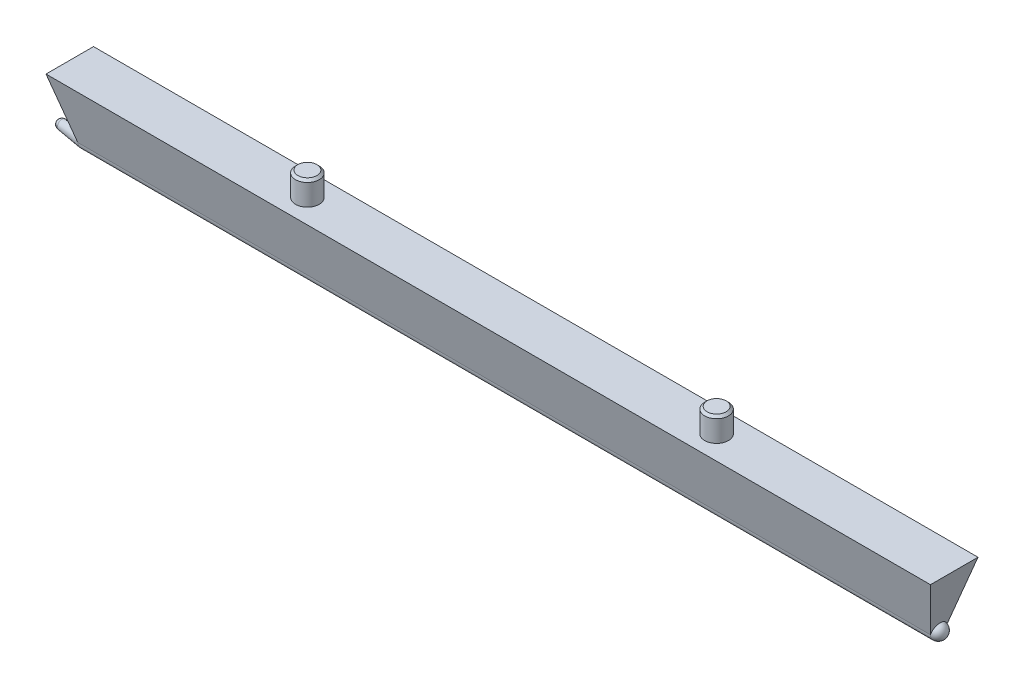
from build123d import *

# Parameters (mm, degrees)
BOSS_EXTRUDE1_DEPTH = 50
BOSS_EXTRUDE1_DRAFT = -15
SKETCH3_R           = 6.602540378
BOSS_EXTRUDE2_DEPTH = 717.605081
SKETCH4_R           = 6.602540378
BOSS_EXTRUDE3_DEPTH = 20
BOSS_EXTRUDE3_TAPER = 8
SKETCH9_R           = 10
BOSS_EXTRUDE4_DEPTH = 20
CHAMFER1_SIZE       = 2


with BuildPart() as part:
    # Sketch1 → Boss-Extrude1 (with draft: the straight prism first)
    with BuildSketch(Plane(origin=(0, 0, 0), x_dir=(1, 0, 0), z_dir=(0, 1, 0))):
        Polygon((0, 0), (0, -20), (744.4, -20), (744.4, 20), (0, 20), align=None)
    extrude(amount=-BOSS_EXTRUDE1_DEPTH)
    # Boss-Extrude1: the draft: its side faces are tilted about the plane it starts from
    boss_extrude1_sides = [part.faces().sort_by_distance(p)[0] for p in [
        (0, -25, 0),
        (744.4, -25, 0),
        (372.2, -25, -20),
        (372.2, -25, 20),
    ]]
    draft(boss_extrude1_sides, Plane(origin=(0, 0, 0), x_dir=(1, 0, 0), z_dir=(0, 1, 0)), BOSS_EXTRUDE1_DRAFT)

    # Sketch3 → Boss-Extrude2 (add)
    with BuildSketch(Plane(origin=(731.002540378, 0, 0), x_dir=(0, 0, -1), z_dir=(1, 0, 0))):
        with Locations((0, -50)):
            Circle(SKETCH3_R)
    extrude(amount=-BOSS_EXTRUDE2_DEPTH)

    # Sketch8 → Revolve3 (revolve)
    with BuildSketch(Plane(origin=(731.002540378, 0, 0), x_dir=(0, 0, -1), z_dir=(1, 0, 0))):
        with BuildLine():
            Line((6.602540378, -50), (-6.602540378, -50))
            ThreePointArc((-6.602540378, -50), (0, -56.602540378), (6.602540378, -50))
        make_face()
    revolve(axis=Axis((731.002540378, -50, 6.602540378), (0, 0, -1)))

    # Sketch9 → Boss-Extrude4 (add)
    with BuildSketch(Plane(origin=(0, 0, 0), x_dir=(1, 0, 0), z_dir=(0, 1, 0))):
        with Locations(Location((200, 0, 0), (0, 0, 90))):
            Circle(SKETCH9_R)
        with Locations(Location((544.4, 0, 0), (0, 0, 90))):
            Circle(SKETCH9_R)
    extrude(amount=BOSS_EXTRUDE4_DEPTH)

    # Chamfer1
    chamfer1_edges = [part.edges().sort_by_distance(p)[0] for p in [
        (200, 20, 10),
        (544.4, 20, 10),
    ]]
    chamfer(chamfer1_edges, length=CHAMFER1_SIZE)


with BuildPart() as body_2:
    # Sketch4 → Boss-Extrude3 (new body)
    with BuildSketch(Plane.ZY.offset(-13.397459622)):
        with Locations((0, -50)):
            Circle(SKETCH4_R)
    extrude(amount=BOSS_EXTRUDE3_DEPTH, taper=BOSS_EXTRUDE3_TAPER)


with BuildPart() as body_3:
    # Sketch6 → Revolve2 (revolve)
    with BuildSketch(Plane.ZY.offset(6.602540378)):
        with BuildLine():
            Line((3.791723684, -50), (-3.791723684, -50))
            ThreePointArc((-3.791723684, -50), (0, -53.791723684), (3.791723684, -50))
        make_face()
    revolve(axis=Axis((-6.602540378, -50, 3.791723684), (0, 0, -1)))


solid = Compound([part.part, body_2.part, body_3.part])
